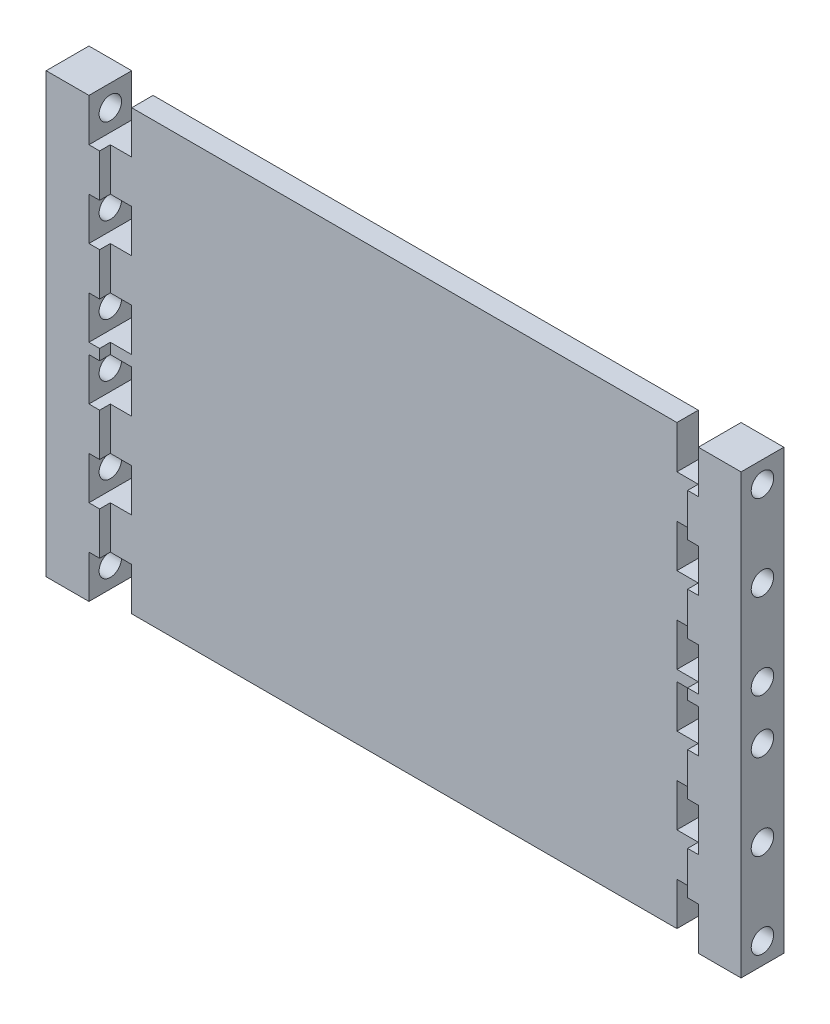
from build123d import *

# Parameters (mm, degrees)
SKETCH_1_W          = 130
SKETCH_1_H          = 82
EXTRUDE_1_DEPTH     = 8
SKETCH_2_R          = 2.1
CUT_EXTRUDE_1_DEPTH = 142.58762947
SKETCH_3_W          = 110
SKETCH_3_H          = 82
EXTRUDE_2_DEPTH     = 8
SKETCH_4_W          = 110
SKETCH_4_H          = 2
CUT_EXTRUDE_2_DEPTH = 125.141148579
SKETCH_7_W          = 6
SKETCH_7_H          = 8
CUT_EXTRUDE_3_DEPTH = 10


with BuildPart() as part:
    # 草圖1 → 填料-伸長1 (new body)
    with BuildSketch(Plane.XY):
        with Locations((27.860243218, 14.525280899)):
            Rectangle(SKETCH_1_W, SKETCH_1_H)
    extrude(amount=EXTRUDE_1_DEPTH)

    # 草圖2 → 除料-伸長1 (cut, through all)
    with BuildSketch(Plane.ZY.offset(37.139756782)):
        with Locations((4, -22.474719101)):
            Circle(SKETCH_2_R)
        with Locations((4, -6.474719101)):
            Circle(SKETCH_2_R)
        with Locations((4, 9.525280899)):
            Circle(SKETCH_2_R)
        with Locations((4, 19.525280899)):
            Circle(SKETCH_2_R)
        with Locations((4, 35.525280899)):
            Circle(SKETCH_2_R)
        with Locations((4, 51.525280899)):
            Circle(SKETCH_2_R)
    extrude(amount=-CUT_EXTRUDE_1_DEPTH, mode=Mode.SUBTRACT)

    # 草圖3 → 填料-伸長2 (add)
    with BuildSketch(Plane(origin=(0, 0, 0), x_dir=(-1, 0, 0), z_dir=(0, 0, -1))):
        with Locations((-27.860243218, 14.525280899)):
            Rectangle(SKETCH_3_W, SKETCH_3_H)
    extrude(amount=-EXTRUDE_2_DEPTH)

    # 草圖4 → 除料-伸長2 (cut, through all)
    with BuildSketch(Plane.XZ.offset(26.474719101)):
        with Locations((27.860243218, 7)):
            Rectangle(SKETCH_4_W, SKETCH_4_H)
        with Locations((27.860243218, 1)):
            Rectangle(SKETCH_4_W, SKETCH_4_H)
    extrude(amount=-CUT_EXTRUDE_2_DEPTH, mode=Mode.SUBTRACT)

    # 草圖7 → 除料-伸長3 (cut)
    with BuildSketch(Plane.XY.offset(8)):
        with Locations((-26.139756782, 51.525280899)):
            Rectangle(SKETCH_7_W, SKETCH_7_H)
        with Locations((81.860243218, 51.525280899)):
            Rectangle(SKETCH_7_W, SKETCH_7_H)
        with Locations((-26.139756782, 35.525280899)):
            Rectangle(SKETCH_7_W, SKETCH_7_H)
        with Locations((81.860243218, 35.525280899)):
            Rectangle(SKETCH_7_W, SKETCH_7_H)
        with Locations((-26.139756782, 19.525280899)):
            Rectangle(SKETCH_7_W, SKETCH_7_H)
        with Locations((81.860243218, 19.525280899)):
            Rectangle(SKETCH_7_W, SKETCH_7_H)
        with Locations((-26.139756782, 9.525280899)):
            Rectangle(SKETCH_7_W, SKETCH_7_H)
        with Locations((81.860243218, 9.525280899)):
            Rectangle(SKETCH_7_W, SKETCH_7_H)
        with Locations((-26.139756782, -6.474719101)):
            Rectangle(SKETCH_7_W, SKETCH_7_H)
        with Locations((81.860243218, -6.474719101)):
            Rectangle(SKETCH_7_W, SKETCH_7_H)
        with Locations((-26.139756782, -22.474719101)):
            Rectangle(SKETCH_7_W, SKETCH_7_H)
        with Locations((81.860243218, -22.474719101)):
            Rectangle(SKETCH_7_W, SKETCH_7_H)
    extrude(amount=-CUT_EXTRUDE_3_DEPTH, mode=Mode.SUBTRACT)


solid = part.part
